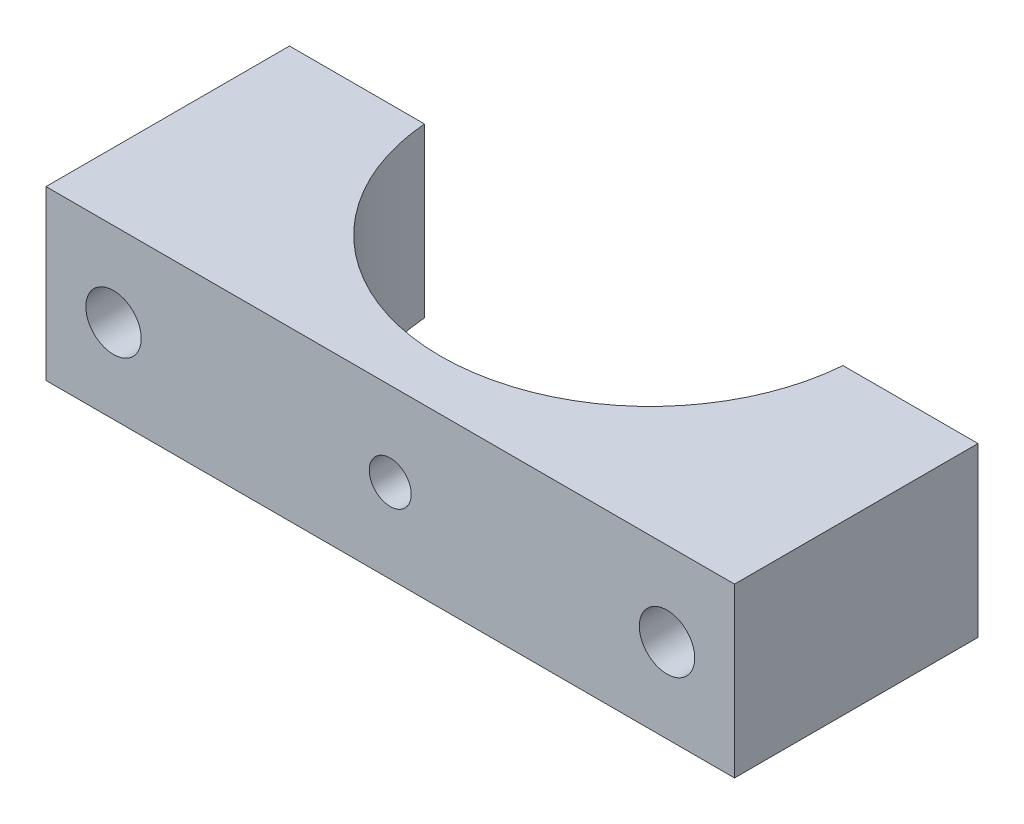
from build123d import *

# Parameters (mm, degrees)
EXTRUDE_1_DEPTH = 10
M4X0_71_D       = 3.3
M3X0_51_D       = 2.5


with BuildPart() as part:
    # Эскиз1 → Бобышка-Вытянуть1 (new body)
    with BuildSketch(Plane(origin=(0, 0, 0), x_dir=(1, 0, 0), z_dir=(0, 1, 0))):
        with BuildLine():
            Line((0, 0), (41, 0))
            Line((41, 0), (41, 14.5))
            Line((41, 14.5), (32.959935794, 14.5))
            ThreePointArc((32.959935794, 14.5), (20.5, 3), (8.040064206, 14.5))
            Line((8.040064206, 14.5), (0, 14.5))
            Line((0, 14.5), (0, 0))
        make_face()
    extrude(amount=EXTRUDE_1_DEPTH)

    # Отверстие обработанное метчиком M4x0.71 (through all)
    with Locations(Plane(origin=(0, 0, -14.5), x_dir=(-1, 0, 0), z_dir=(0, 0, -1))):
        with Locations((-36.979967897, 5), (-4.020032103, 5)):
            Hole(M4X0_71_D / 2)

    # Отверстие обработанное метчиком M3x0.51 (through all)
    with Locations(Plane.XY):
        with Locations((20.5, 5)):
            Hole(M3X0_51_D / 2)


solid = part.part
